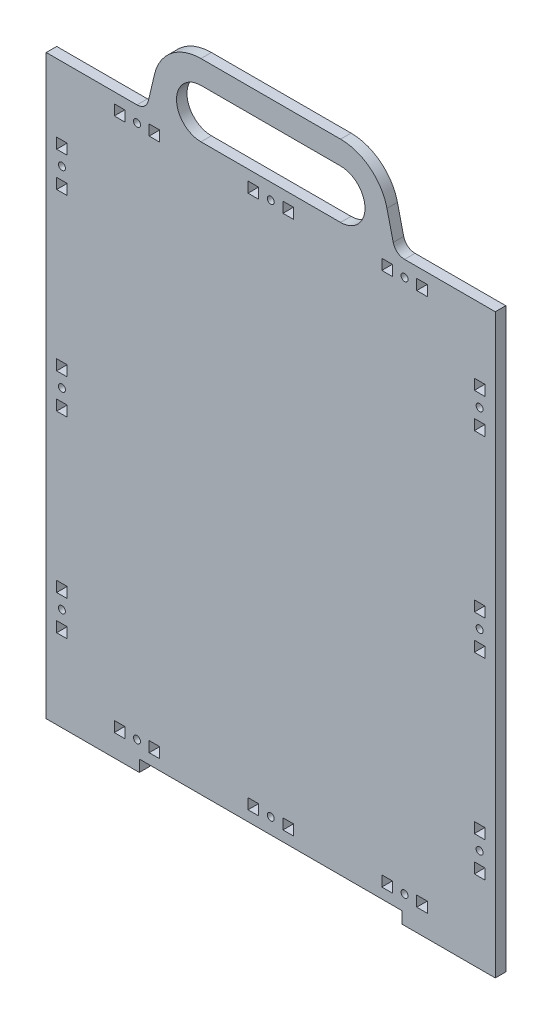
from build123d import *

# Parameters (mm, degrees)
SKETCH1_R           = 3
SKETCH1_W           = 9.05
SKETCH1_H           = 9.05
BOSS_EXTRUDE1_DEPTH = 9


with BuildPart() as part:
    # Sketch1 → Boss-Extrude1 (new body)
    with BuildSketch(Plane.XY):
        with BuildLine():
            Line((-193, 243), (-193, -253))
            Line((-193, -253), (-113, -253))
            Line((-113, -253), (-113, -243))
            Line((-113, -243), (113, -243))
            Line((113, -243), (113, -253))
            Line((113, -253), (193, -253))
            Line((193, -253), (193, 243))
            Line((193, 243), (115, 243))
            ThreePointArc((115, 243), (108.794404951, 245.158406406), (105.267649124, 250.701881983))
            Line((105.267649124, 250.701881983), (99.902638592, 273.422283872))
            ThreePointArc((99.902638592, 273.422283872), (85.442939701, 296.150533734), (60, 305))
            Line((60, 305), (-60, 305))
            ThreePointArc((-60, 305), (-85.442939701, 296.150533734), (-99.902638592, 273.422283872))
            Line((-99.902638592, 273.422283872), (-105.267649124, 250.701881983))
            ThreePointArc((-105.267649124, 250.701881983), (-108.794404951, 245.158406406), (-115, 243))
            Line((-115, 243), (-193, 243))
        make_face()
        with Locations((115, 229.525)):
            Circle(SKETCH1_R, mode=Mode.SUBTRACT)
        with Locations((179.525, 0)):
            Circle(SKETCH1_R, mode=Mode.SUBTRACT)
        with Locations((179.525, 165)):
            Circle(SKETCH1_R, mode=Mode.SUBTRACT)
        with Locations((0, 229.525)):
            Circle(SKETCH1_R, mode=Mode.SUBTRACT)
        with Locations(Location((-179.525, 0, 0), (0, 0, 180))):
            Circle(SKETCH1_R, mode=Mode.SUBTRACT)
        with Locations(Location((-115, 229.525, 0), (0, 0, 180))):
            Circle(SKETCH1_R, mode=Mode.SUBTRACT)
        with Locations(Location((-179.525, 165, 0), (0, 0, 180))):
            Circle(SKETCH1_R, mode=Mode.SUBTRACT)
        with Locations(Location((115, -229.525, 0), (0, 0, 90))):
            Circle(SKETCH1_R, mode=Mode.SUBTRACT)
        with Locations((-115, -229.525)):
            Circle(SKETCH1_R, mode=Mode.SUBTRACT)
        with Locations((-179.525, -165)):
            Circle(SKETCH1_R, mode=Mode.SUBTRACT)
        with Locations(Location((179.525, -165, 0), (0, 0, 90))):
            Circle(SKETCH1_R, mode=Mode.SUBTRACT)
        with Locations(Location((0, -229.525, 0), (0, 0, 90))):
            Circle(SKETCH1_R, mode=Mode.SUBTRACT)
        with BuildLine():
            Line((-60, 285), (60, 285))
            ThreePointArc((60, 285), (81, 264), (60, 243))
            Line((60, 243), (-60, 243))
            ThreePointArc((-60, 243), (-81, 264), (-60, 285))
        make_face(mode=Mode.SUBTRACT)
        with Locations((130, 229.525)):
            Rectangle(SKETCH1_W, SKETCH1_H, mode=Mode.SUBTRACT)
        with Locations((100, 229.525)):
            Rectangle(SKETCH1_W, SKETCH1_H, mode=Mode.SUBTRACT)
        with Locations((179.525, 15)):
            Rectangle(SKETCH1_W, SKETCH1_H, mode=Mode.SUBTRACT)
        with Locations((179.525, -15)):
            Rectangle(SKETCH1_W, SKETCH1_H, mode=Mode.SUBTRACT)
        with Locations((179.525, 180)):
            Rectangle(SKETCH1_W, SKETCH1_H, mode=Mode.SUBTRACT)
        with Locations((179.525, 150)):
            Rectangle(SKETCH1_W, SKETCH1_H, mode=Mode.SUBTRACT)
        with Locations((15, 229.525)):
            Rectangle(SKETCH1_W, SKETCH1_H, mode=Mode.SUBTRACT)
        with Locations((-15, 229.525)):
            Rectangle(SKETCH1_W, SKETCH1_H, mode=Mode.SUBTRACT)
        with Locations((-179.525, 15)):
            Rectangle(SKETCH1_W, SKETCH1_H, mode=Mode.SUBTRACT)
        with Locations((-179.525, -15)):
            Rectangle(SKETCH1_W, SKETCH1_H, mode=Mode.SUBTRACT)
        with Locations((-130, 229.525)):
            Rectangle(SKETCH1_W, SKETCH1_H, mode=Mode.SUBTRACT)
        with Locations((-100, 229.525)):
            Rectangle(SKETCH1_W, SKETCH1_H, mode=Mode.SUBTRACT)
        with Locations((-179.525, 180)):
            Rectangle(SKETCH1_W, SKETCH1_H, mode=Mode.SUBTRACT)
        with Locations((-179.525, 150)):
            Rectangle(SKETCH1_W, SKETCH1_H, mode=Mode.SUBTRACT)
        with Locations((130, -229.525)):
            Rectangle(SKETCH1_W, SKETCH1_H, mode=Mode.SUBTRACT)
        with Locations((100, -229.525)):
            Rectangle(SKETCH1_W, SKETCH1_H, mode=Mode.SUBTRACT)
        with Locations((-130, -229.525)):
            Rectangle(SKETCH1_W, SKETCH1_H, mode=Mode.SUBTRACT)
        with Locations((-100, -229.525)):
            Rectangle(SKETCH1_W, SKETCH1_H, mode=Mode.SUBTRACT)
        with Locations((-179.525, -180)):
            Rectangle(SKETCH1_W, SKETCH1_H, mode=Mode.SUBTRACT)
        with Locations((-179.525, -150)):
            Rectangle(SKETCH1_W, SKETCH1_H, mode=Mode.SUBTRACT)
        with Locations((179.525, -180)):
            Rectangle(SKETCH1_W, SKETCH1_H, mode=Mode.SUBTRACT)
        with Locations((179.525, -150)):
            Rectangle(SKETCH1_W, SKETCH1_H, mode=Mode.SUBTRACT)
        with Locations((15, -229.525)):
            Rectangle(SKETCH1_W, SKETCH1_H, mode=Mode.SUBTRACT)
        with Locations((-15, -229.525)):
            Rectangle(SKETCH1_W, SKETCH1_H, mode=Mode.SUBTRACT)
    extrude(amount=BOSS_EXTRUDE1_DEPTH)


solid = part.part
